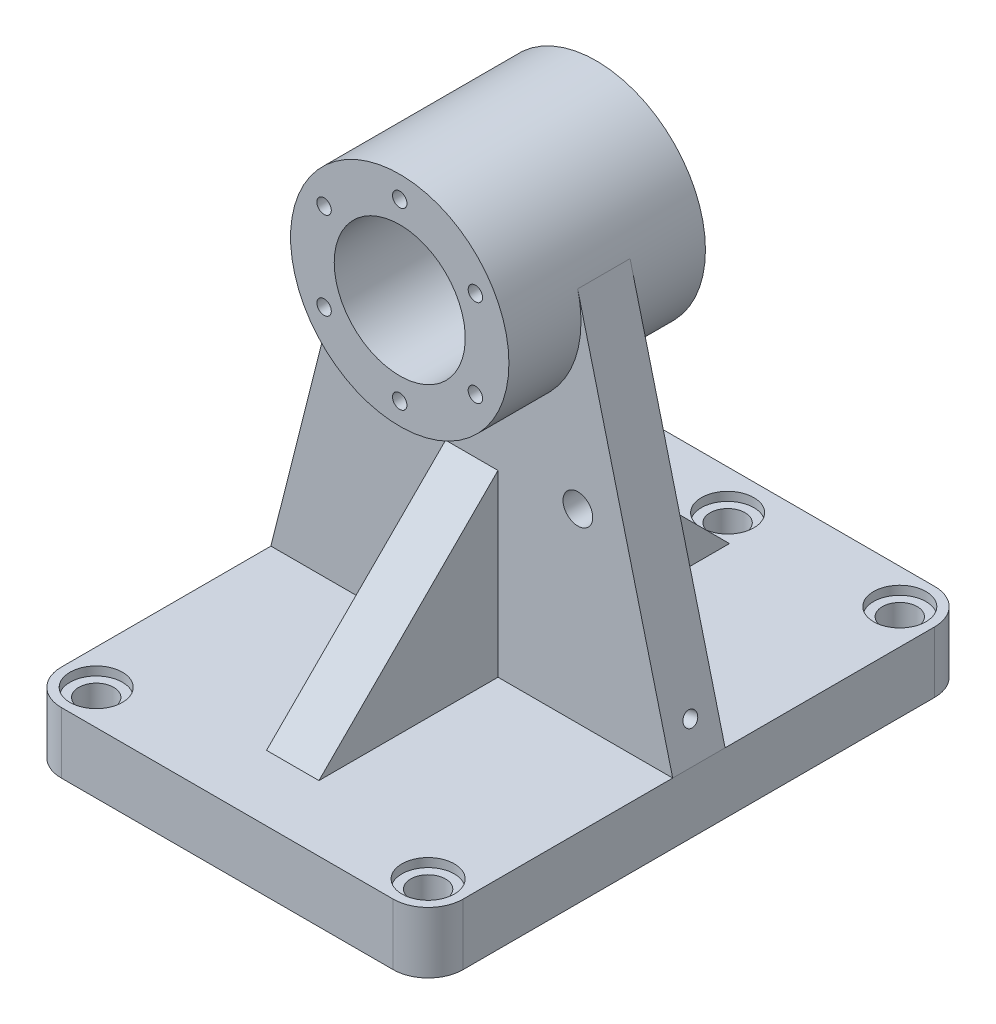
from build123d import *

# Parameters (mm, degrees)
SKETCH_1_R                     = 25
SKETCH_1_R_2                   = 15
EXTRUDE_1_DEPTH                = 22.5
SKETCH_2_W                     = 92
SKETCH_2_H                     = 14
EXTRUDE_2_DEPTH                = 62
EXTRUDE_3_DEPTH                = 6
RIB_1_REACH                    = 123.639
SKETCH_4_WALL_W                = 303.26037525
SKETCH_4_WALL_H                = 12
FILLET_1_R                     = 8
HOLE_WIZARD_M1_6_1_D           = 8
HOLE_WIZARD_M1_6_1_CBORE_D     = 12
HOLE_WIZARD_M1_6_1_CBORE_DEPTH = 2
HOLE_WIZARD_M6_1_D             = 5
HOLE_WIZARD_M8_1_D             = 6.8
PATTERN_CIRCULAR_1_COUNT       = 6
HOLE_WIZARD_M4_2_D             = 3.3
HOLE_WIZARD_M4_2_DEPTH         = 11.5
HOLE_WIZARD_M4_2_TIP           = 0.991420021


with BuildPart() as part:
    # 스케치1 → 보스-돌출1 (new, symmetric)
    with BuildSketch(Plane.XY):
        with Locations(Location((0, 0, 0), (0, 0, 180))):
            Circle(SKETCH_1_R)
        with Locations(Location((0, 0, 0), (0, 0, 180))):
            Circle(SKETCH_1_R_2, mode=Mode.SUBTRACT)
    extrude(amount=EXTRUDE_1_DEPTH, both=True)



with BuildPart() as body_2:
    # 스케치2 → 보스-돌출2 (new, symmetric)
    with BuildSketch(Plane.XY):
        with Locations((0, -87)):
            Rectangle(SKETCH_2_W, SKETCH_2_H)
    extrude(amount=EXTRUDE_2_DEPTH, both=True)


with BuildPart() as part_1:
    add(part.part)

    add(body_2.part)  # 보스-돌출3 merges body 2
    # 스케치3 → 보스-돌출3 (add, symmetric)
    with BuildSketch(Plane.XY):
        with BuildLine():
            Line((-24.238210613, 6.124471102), (-46, -80))
            Line((-46, -80), (46, -80))
            Line((46, -80), (24.238210613, 6.124471102))
            ThreePointArc((24.238210613, 6.124471102), (0, -25), (-24.238210613, 6.124471102))
        make_face()
    extrude(amount=EXTRUDE_3_DEPTH, both=True)

    # 스케치4 wall → 보강대1 (add, up to next)
    with BuildSketch(Plane(origin=(0, -59.5, 26.5), x_dir=(0, -0.707106781187, 0.707106781187), z_dir=(0, -0.707106781187, -0.707106781187)), mode=Mode.PRIVATE) as rib_1_sk1:
        Rectangle(SKETCH_4_WALL_W, SKETCH_4_WALL_H)
    rib_1_tool1 = extrude(rib_1_sk1.sketch, amount=RIB_1_REACH, mode=Mode.PRIVATE) - part_1.part
    rib_1 = rib_1_tool1.solids().sort_by_distance((0, -59.5, 26.5))[0]
    add(rib_1)

    # 대칭 복사1: 보강대1 across plane
    add(rib_1.mirror(Plane.XY))

    # 필렛1
    fillet_1_edges = [part_1.edges().sort_by_distance(p)[0] for p in [
        (-46, -87, -62),
        (46, -87, -62),
        (-46, -87, 62),
        (46, -87, 62),
    ]]
    fillet(fillet_1_edges, radius=FILLET_1_R)

    # M1.6 소켓 머리 캡 나사용 카운터보어1 (through all)
    with Locations(Plane(origin=(-38, -80, 54), x_dir=(0, 0, 1), z_dir=(0, 1, 0))):
        with Locations((0, 0), (0, 76), (-108, 76), (-108, 0)):
            CounterBoreHole(HOLE_WIZARD_M1_6_1_D / 2, HOLE_WIZARD_M1_6_1_CBORE_D / 2, HOLE_WIZARD_M1_6_1_CBORE_DEPTH)

    # M6 나사 구멍1 (through all)
    with Locations(Plane(origin=(-22.914678554, -34.420983867, 6), x_dir=(1, 0, 0), z_dir=(0, 0, 1))):
        with Locations((0, 0)):
            Hole(HOLE_WIZARD_M6_1_D / 2)

    # M8 나사 구멍1 (through all)
    with Locations(Plane(origin=(24.290456281, -37.484031993, 6), x_dir=(1, 0, 0), z_dir=(0, 0, 1))):
        with Locations((0, 0)):
            Hole(HOLE_WIZARD_M8_1_D / 2)

    # 스케치11 → M1.6 소켓 머리 캡 나사용 카운터보어2 (revolve, cut)
    with BuildSketch(Plane(origin=(-0.334351045, -80, -52.911409403), x_dir=(0, 0, 1), z_dir=(1, 0, 0))):
        Polygon((0, 0), (0, 14), (4, 14), (4, 2), (6, 2), (6, 0), align=None)
    revolve(axis=Axis((-0.334351045, -73.65, -52.911409403), (0, -1, 0)), mode=Mode.SUBTRACT)

    # 스케치15 → M4 나사 구멍1 (revolve, cut)
    with BuildSketch(Plane(origin=(0, 20, 22.5), x_dir=(0, -1, 0), z_dir=(1, 0, 0))):
        Polygon((0, 0), (0, 12.491420021), (1.65, 11.5), (1.65, 0), align=None)
    hole_wizard_m4_1 = revolve(axis=Axis((0, 20, 28.85), (0, 0, -1)), mode=Mode.SUBTRACT)

    # 원형 패턴1: M4 나사 구멍1 ×6 about axis
    pattern_circular_1_axis = Axis((0, 0, 0), (0, 0, 1))
    for i in range(1, PATTERN_CIRCULAR_1_COUNT):
        add(hole_wizard_m4_1.rotate(pattern_circular_1_axis, i * 360 / PATTERN_CIRCULAR_1_COUNT), mode=Mode.SUBTRACT)

    # 대칭 복사2: M4 나사 구멍1 across plane
    add(hole_wizard_m4_1.mirror(Plane.XY), mode=Mode.SUBTRACT)

    # 대칭 복사2 copy 1 sketch → 대칭 복사2 copy 1 (revolve, cut)
    with BuildSketch(Plane(origin=(-17.320508076, 10, -22.5), x_dir=(0.8660254037844386, -0.5000000000000001, 0), z_dir=(0.5000000000000001, 0.8660254037844386, 0))):
        Polygon((0, 0), (0, -12.491420021), (1.65, -11.5), (1.65, 0), align=None)
    revolve(axis=Axis((-17.320508076, 10, -28.85), (0, 0, -1)), mode=Mode.SUBTRACT)

    # 대칭 복사2 copy 2 sketch → 대칭 복사2 copy 2 (revolve, cut)
    with BuildSketch(Plane(origin=(-17.320508076, -10, -22.5), x_dir=(0.8660254037844387, 0.4999999999999998, 0), z_dir=(-0.4999999999999998, 0.8660254037844387, 0))):
        Polygon((0, 0), (0, -12.491420021), (1.65, -11.5), (1.65, 0), align=None)
    revolve(axis=Axis((-17.320508076, -10, -28.85), (0, 0, -1)), mode=Mode.SUBTRACT)

    # 대칭 복사2 copy 3 sketch → 대칭 복사2 copy 3 (revolve, cut)
    with BuildSketch(Plane(origin=(0, -20, -22.5), x_dir=(0, 1, 0), z_dir=(-1, 0, 0))):
        Polygon((0, 0), (0, -12.491420021), (1.65, -11.5), (1.65, 0), align=None)
    revolve(axis=Axis((0, -20, -28.85), (0, 0, -1)), mode=Mode.SUBTRACT)

    # 대칭 복사2 copy 4 sketch → 대칭 복사2 copy 4 (revolve, cut)
    with BuildSketch(Plane(origin=(17.320508076, -10, -22.5), x_dir=(-0.8660254037844384, 0.5000000000000004, 0), z_dir=(-0.5000000000000004, -0.8660254037844384, 0))):
        Polygon((0, 0), (0, -12.491420021), (1.65, -11.5), (1.65, 0), align=None)
    revolve(axis=Axis((17.320508076, -10, -28.85), (0, 0, -1)), mode=Mode.SUBTRACT)

    # 대칭 복사2 copy 5 sketch → 대칭 복사2 copy 5 (revolve, cut)
    with BuildSketch(Plane(origin=(17.320508076, 10, -22.5), x_dir=(-0.8660254037844386, -0.5000000000000001, 0), z_dir=(0.5000000000000001, -0.8660254037844386, 0))):
        Polygon((0, 0), (0, -12.491420021), (1.65, -11.5), (1.65, 0), align=None)
    revolve(axis=Axis((17.320508076, 10, -28.85), (0, 0, -1)), mode=Mode.SUBTRACT)

    # M4 나사 구멍2
    with Locations(Plane(origin=(44.040169247, -72.243772604, 0), x_dir=(-0.244978844097, 0.969528424516, 0), z_dir=(0.969528424516, 0.244978844097, 0))):
        with Locations((0, 0)):
            Hole(HOLE_WIZARD_M4_2_D / 2, depth=HOLE_WIZARD_M4_2_DEPTH)
            with Locations((0, 0, -(HOLE_WIZARD_M4_2_DEPTH + HOLE_WIZARD_M4_2_TIP / 2))):  # 118° drill point
                Cone(0, HOLE_WIZARD_M4_2_D / 2, HOLE_WIZARD_M4_2_TIP, mode=Mode.SUBTRACT)


solid = part_1.part
